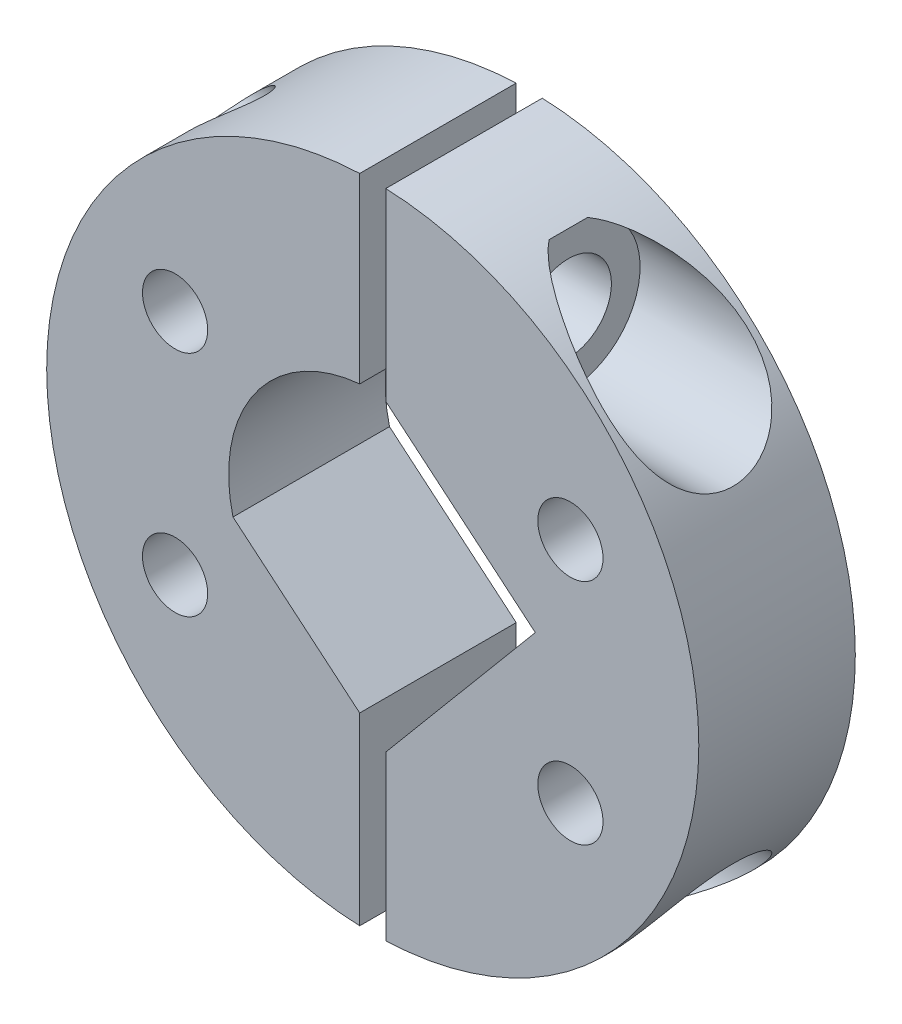
from build123d import *

# Parameters (mm, degrees)
SKETCH_7_R                  = 25
EXTRUDE_1_DEPTH             = 6
CUT_EXTRUDE_1_DEPTH         = 36.860842154
CUT_EXTRUDE_1_DEPTH_BACK    = 36.860842154
SKETCH_18_W                 = 2.5
SKETCH_18_H                 = 12
PATTERN_CIRCULAR_2_COUNT    = 6
HOLE_WIZARD_M6_1_AT_2_COUNT = 2
HOLE_WIZARD_M6_1_AT_2_PITCH = 36.048949672
SKETCH_29_W                 = 2.5
SKETCH_29_H                 = 40
M6X1_0_3_AT_2_COUNT         = 2
M6X1_0_3_AT_2_PITCH         = 36.048949672
SKETCH_30_R                 = 5.5
CUT_EXTRUDE_2_DEPTH         = 48.539457445


with BuildPart() as part:
    # 스케치7 → 보스-돌출1 (new, symmetric)
    with BuildSketch(Plane.XY):
        Circle(SKETCH_7_R)
        with BuildLine():
            Line((12.464303027, 1.224603167), (0.958404813, -12.487592365))
            Line((0.958404813, -12.487592365), (-10.7161125, -2.691509193))
            ThreePointArc((-10.7161125, -2.691509193), (-8.463986498, 7.102127949), (0.789785713, 11.020686339))
            Line((0.789785713, 11.020686339), (12.464303027, 1.224603167))
        make_face(mode=Mode.SUBTRACT)
    extrude(amount=EXTRUDE_1_DEPTH, both=True)

    # 스케치19 → 컷-돌출1 (cut, two sides: drawn at the far end of the back side and taken through both)
    with BuildSketch(Plane.XY.offset(-CUT_EXTRUDE_1_DEPTH_BACK)):
        with BuildLine():
            Line((1, 24.979991994), (1, -24.979991994))
            ThreePointArc((1, -24.979991994), (0, -25), (-1, -24.979991994))
            Line((-1, -24.979991994), (-1, 24.979991994))
            ThreePointArc((-1, 24.979991994), (0, 25), (1, 24.979991994))
        make_face()
    extrude(amount=CUT_EXTRUDE_1_DEPTH + CUT_EXTRUDE_1_DEPTH_BACK, mode=Mode.SUBTRACT)


with BuildPart() as cut_extrude_1_piece_1:
    # of the separate pieces the step leaves, piece 1, a body of its own (cut_extrude_1_pieces)
    add(part.part.solids().sort_by_distance((1, 24.979991994, 6))[0])

    # 스케치18 → M6x1.0 나사 구멍1 (revolve, cut)
    with BuildSketch(Plane(origin=(15.155444566, 8.75, 6), x_dir=(0, -1, 0), z_dir=(1, 0, 0))):
        with Locations((1.25, 6)):
            Rectangle(SKETCH_18_W, SKETCH_18_H)
    m6x1_0_1 = revolve(axis=Axis((15.155444566, 8.75, 12.35), (0, 0, -1)), mode=Mode.SUBTRACT)


with BuildPart() as cut_extrude_1_piece_2:
    # of the separate pieces the step leaves, piece 2, a body of its own (cut_extrude_1_pieces)
    add(part.part.solids().sort_by_distance((-1, 24.979991994, -6))[0])


with BuildPart() as pattern_circular_2_tool:
    # 원형 패턴2: M6x1.0 나사 구멍1 ×6 about axis, 2 skipped
    pattern_circular_2_axis = Axis((0, 0, 0), (0, 0, -1))
    add([m6x1_0_1.rotate(pattern_circular_2_axis, i * 360 / PATTERN_CIRCULAR_2_COUNT) for i in range(1, PATTERN_CIRCULAR_2_COUNT) if i not in (2, 5)])


with BuildPart() as cut_extrude_1_piece_1_1:
    add(cut_extrude_1_piece_1.part)

    # 원형 패턴2: cut by pattern_circular_2_tool
    add(pattern_circular_2_tool.part, mode=Mode.SUBTRACT)

    # 스케치23 → M6 소켓 머리 캡 나사용 카운터보어1 (revolve, cut)
    with BuildSketch(Plane(origin=(15, 18.024474836, 0), x_dir=(0, 0, -1), z_dir=(0, 1, 0))):
        Polygon((0, 0), (0, 40), (3.3, 40), (3.3, 6), (5.5, 6), (5.5, 0), align=None)
    hole_wizard_m6_1 = revolve(axis=Axis((21.35, 18.024474836, 0), (-1, 0, 0)), mode=Mode.SUBTRACT)

    # M6 소켓 머리 캡 나사용 카운터보어1 at 2: M6 소켓 머리 캡 나사용 카운터보어1 ×2
    with Locations(*[(0, -i * HOLE_WIZARD_M6_1_AT_2_PITCH, 0) for i in range(1, HOLE_WIZARD_M6_1_AT_2_COUNT)]):
        add(hole_wizard_m6_1, mode=Mode.SUBTRACT)

    # 스케치30 → 컷-돌출2 (cut, through all)
    with BuildSketch(Plane(origin=(15, 0, 0), x_dir=(0, 0, -1), z_dir=(1, 0, 0))):
        with Locations((0, 18.024474836)):
            Circle(SKETCH_30_R)
        with Locations((0, -18.024474836)):
            Circle(SKETCH_30_R)
    extrude(amount=CUT_EXTRUDE_2_DEPTH, mode=Mode.SUBTRACT)


with BuildPart() as cut_extrude_1_piece_2_1:
    add(cut_extrude_1_piece_2.part)

    # 원형 패턴2: cut by pattern_circular_2_tool
    add(pattern_circular_2_tool.part, mode=Mode.SUBTRACT)

    # 스케치29 → M6x1.0 나사 구멍3 (revolve, cut)
    with BuildSketch(Plane(origin=(15, 18.024474836, 0), x_dir=(0, 0, -1), z_dir=(0, 1, 0))):
        with Locations((1.25, 20)):
            Rectangle(SKETCH_29_W, SKETCH_29_H)
    m6x1_0_3 = revolve(axis=Axis((21.35, 18.024474836, 0), (-1, 0, 0)), mode=Mode.SUBTRACT)

    # M6x1.0 나사 구멍3 at 2: M6x1.0 나사 구멍3 ×2
    with Locations(*[(0, -i * M6X1_0_3_AT_2_PITCH, 0) for i in range(1, M6X1_0_3_AT_2_COUNT)]):
        add(m6x1_0_3, mode=Mode.SUBTRACT)


solid = Compound([cut_extrude_1_piece_1_1.part, cut_extrude_1_piece_2_1.part])
